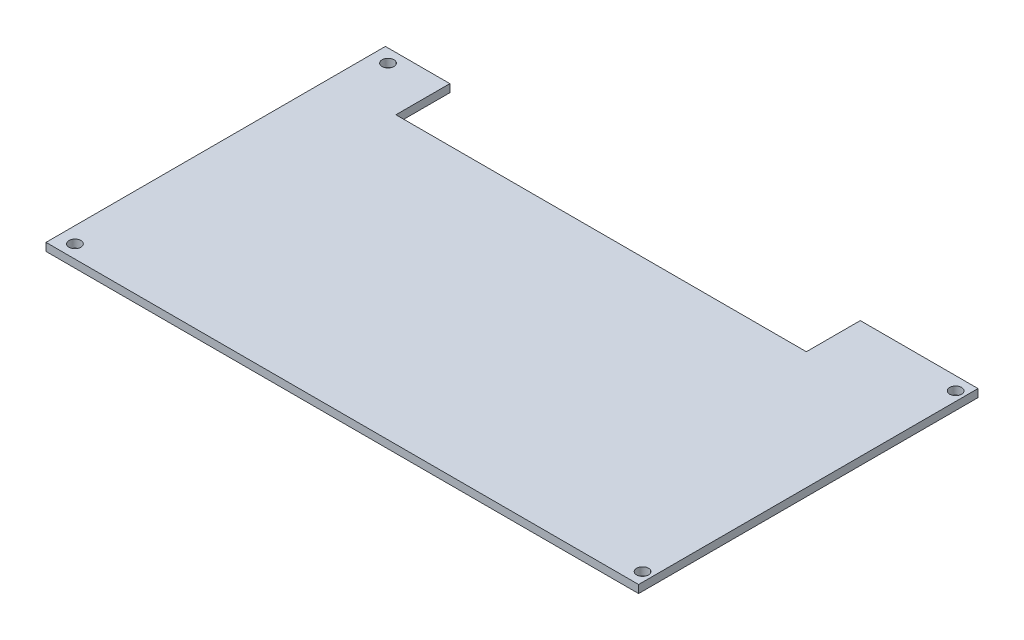
from build123d import *

# Parameters (mm, degrees)
BOSS_EXTRUDE1_DEPTH      = 3
M4_CLEARANCE_HOLE1_D     = 4.5
M4_CLEARANCE_HOLE1_DEPTH = 12
M4_CLEARANCE_HOLE1_TIP   = 1.351936393


with BuildPart() as part:
    # Sketch1 → Boss-Extrude1 (new body)
    with BuildSketch(Plane(origin=(0, 0, 0), x_dir=(1, 0, 0), z_dir=(0, 1, 0))):
        Polygon((-112.62, 129), (-112.62, 0), (112.62, 0), (112.62, 129), (67.88, 129), (67.88, 108.5), (-88.12, 108.5), (-88.12, 129), align=None)
    extrude(amount=BOSS_EXTRUDE1_DEPTH)

    # M4 Clearance Hole1
    with Locations(Plane(origin=(0, 3, 0), x_dir=(1, 0, 0), z_dir=(0, 1, 0))):
        with Locations((-106.62, 5), (-106.62, 124), (109.12, 124), (109.12, 5)):
            Hole(M4_CLEARANCE_HOLE1_D / 2, depth=M4_CLEARANCE_HOLE1_DEPTH)
            with Locations((0, 0, -(M4_CLEARANCE_HOLE1_DEPTH + M4_CLEARANCE_HOLE1_TIP / 2))):  # 118° drill point
                Cone(0, M4_CLEARANCE_HOLE1_D / 2, M4_CLEARANCE_HOLE1_TIP, mode=Mode.SUBTRACT)


solid = part.part
